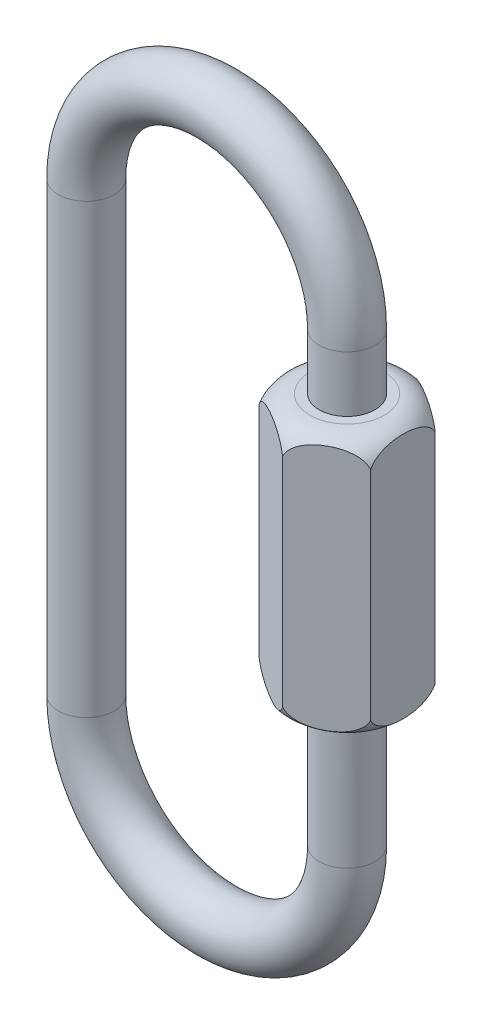
from build123d import *

# Parameters (mm, degrees)
SKETCH1_R           = 1.5
BOSS_EXTRUDE1_START = -3
BOSS_EXTRUDE1_DEPTH = 14


with BuildPart() as part:
    # Sweep1: sweep along a path in Sketch2
    with BuildLine(Plane.XY) as sweep1_path:
        Line((-7, 7), (-7, 31))
        ThreePointArc((-7, 31), (0, 38), (7, 31))
        Line((7, 31), (7, 7))
        ThreePointArc((7, 7), (4.949747468, 2.050252532), (0, 0))
        ThreePointArc((0, 0), (-4.949747468, 2.050252532), (-7, 7))
    # Sketch1 → Sweep1 (sweep)
    with BuildSketch(Plane(origin=(0, 0, 0), x_dir=(0, 0, -1), z_dir=(1, 0, 0))):
        Circle(SKETCH1_R)
    sweep(path=sweep1_path.line)

    # Sketch3 → Boss-Extrude1 (add)
    with BuildSketch(Plane(origin=(7, 31, 0), x_dir=(-1, 0, 0), z_dir=(0, 1, 0)).offset(BOSS_EXTRUDE1_START)):
        Polygon((-3, 1.732050808), (-3, -1.732050808), (0, -3.464101615), (3, -1.732050808), (3, 1.732050808), (0, 3.464101615), align=None)
    extrude(amount=-BOSS_EXTRUDE1_DEPTH)

    # Sketch4 → Cut-Revolve1 (revolve, cut)
    with BuildSketch(Plane.XY):
        with BuildLine():
            Line((9, 14), (9, 12))
            Line((9, 12), (12.5, 12))
            Line((12.5, 12), (12.5, 30.009340499))
            Line((12.5, 30.009340499), (9, 30.009340499))
            Line((9, 30.009340499), (9, 28))
            ThreePointArc((9, 28), (10.060660172, 27.560660172), (10.5, 26.5))
            Line((10.5, 26.5), (10.5, 15.5))
            ThreePointArc((10.5, 15.5), (10.060660172, 14.439339828), (9, 14))
        make_face()
    revolve(axis=Axis((7, 7, 0), (0, 1, 0)), mode=Mode.SUBTRACT)


solid = part.part
